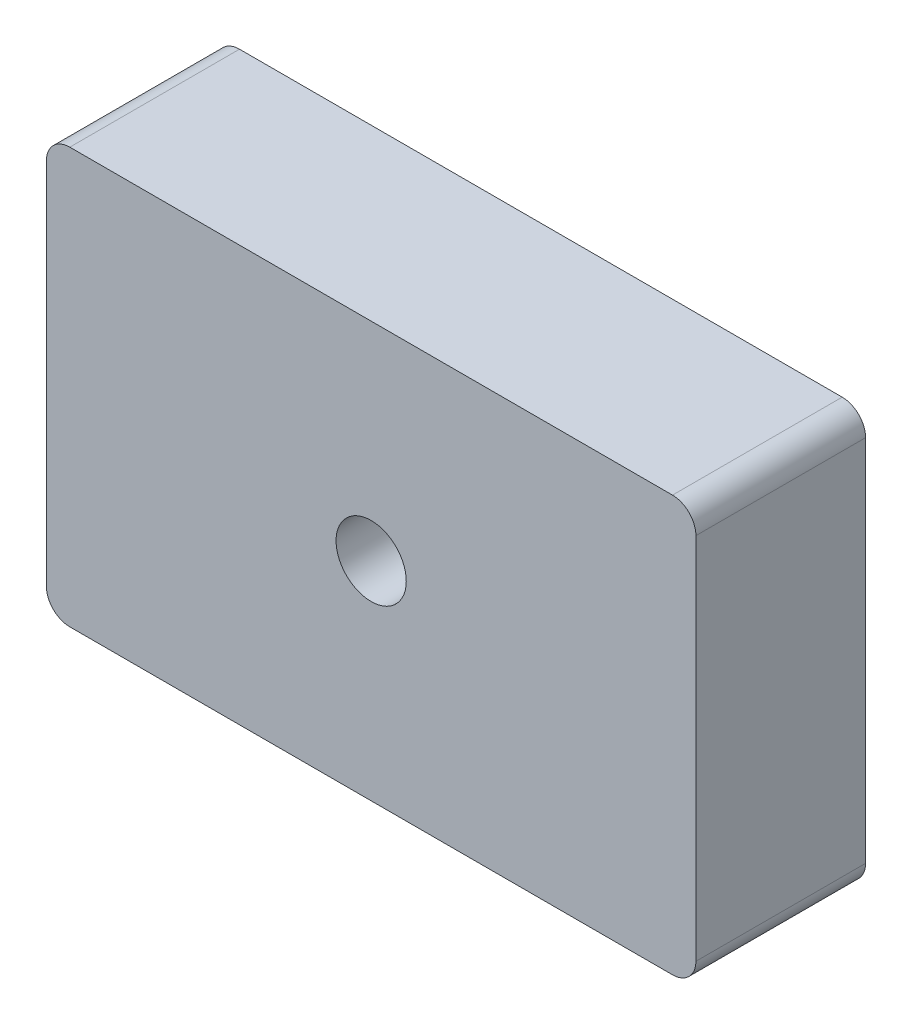
from build123d import *

# Parameters (mm, degrees)
SKETCH2_W           = 70.484
SKETCH2_H           = 45.085
BOSS_EXTRUDE1_DEPTH = 18.415
FILLET1_R           = 2.54
SKETCH3_R           = 3.81
CUT_EXTRUDE1_DEPTH  = 46.708588856


with BuildPart() as part:
    # Sketch2 → Boss-Extrude1 (new body)
    with BuildSketch(Plane.XY):
        Rectangle(SKETCH2_W, SKETCH2_H)
    extrude(amount=BOSS_EXTRUDE1_DEPTH)

    # Fillet1
    fillet1_edges = [part.edges().sort_by_distance(p)[0] for p in [
        (35.242, -22.5425, 9.2075),
        (-35.242, -22.5425, 9.2075),
        (-35.242, 22.5425, 9.2075),
        (35.242, 22.5425, 9.2075),
    ]]
    fillet(fillet1_edges, radius=FILLET1_R)

    # Sketch3 → Cut-Extrude1 (cut, through all)
    with BuildSketch(Plane.XY.offset(18.415)):
        Circle(SKETCH3_R)
    extrude(amount=-CUT_EXTRUDE1_DEPTH, mode=Mode.SUBTRACT)


solid = part.part
